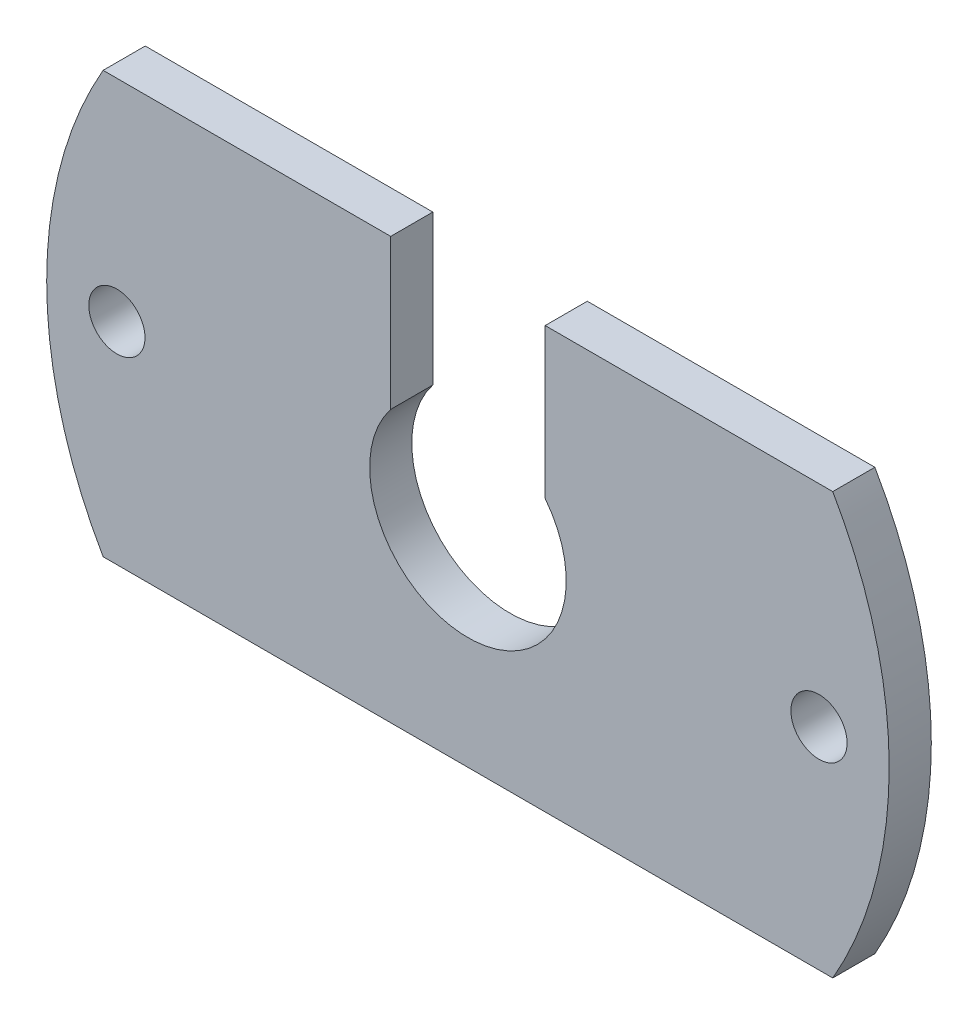
from build123d import *

# Parameters (mm, degrees)
ESQUISSE1_R        = 2
BOSS_EXTRU_1_DEPTH = 3


with BuildPart() as part:
    # Esquisse1 → Boss.-Extru.1 (new body)
    with BuildSketch(Plane.XY):
        with BuildLine():
            Line((-5.5, 15), (-25.980762114, 15))
            ThreePointArc((-25.980762114, 15), (-30, 0), (-25.980762114, -15))
            Line((-25.980762114, -15), (25.980762114, -15))
            ThreePointArc((25.980762114, -15), (30, 0), (25.980762114, 15))
            Line((25.980762114, 15), (5.5, 15))
            Line((5.5, 15), (5.5, 4.330127019))
            ThreePointArc((5.5, 4.330127019), (0, -7), (-5.5, 4.330127019))
            Line((-5.5, 4.330127019), (-5.5, 15))
        make_face()
        with Locations((-25, 0)):
            Circle(ESQUISSE1_R, mode=Mode.SUBTRACT)
        with Locations((25, 0)):
            Circle(ESQUISSE1_R, mode=Mode.SUBTRACT)
    extrude(amount=BOSS_EXTRU_1_DEPTH)


solid = part.part
